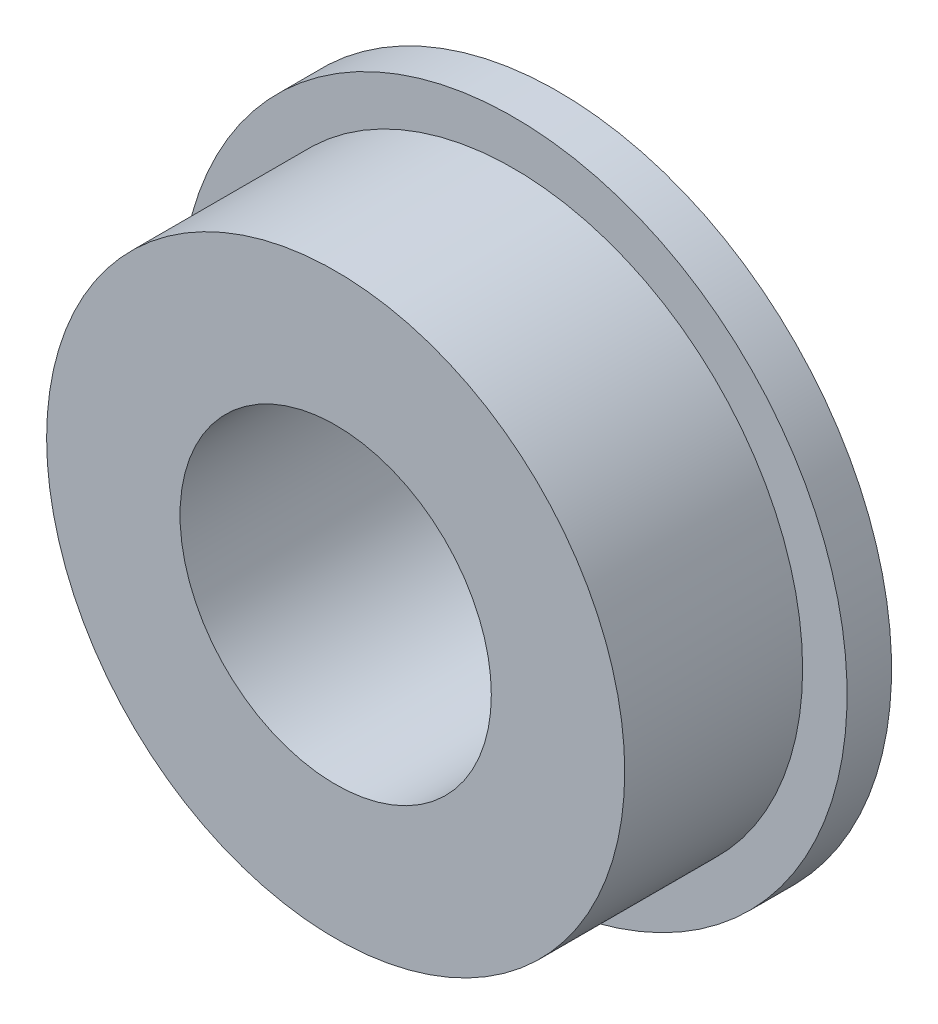
from build123d import *

# Parameters (mm, degrees)
SKETCH_1_R          = 6.5
EXTRUDE_1_DEPTH     = 5
SKETCH_2_R          = 7.5
EXTRUDE_2_DEPTH     = 1
SKETCH_3_R          = 3.5
CUT_EXTRUDE_1_DEPTH = 12.7260394


with BuildPart() as part:
    # ｽｹｯﾁ1 → ﾎﾞｽ - 押し出し1 (new body)
    with BuildSketch(Plane.XY):
        Circle(SKETCH_1_R)
    extrude(amount=EXTRUDE_1_DEPTH)

    # ｽｹｯﾁ2 → ﾎﾞｽ - 押し出し2 (add)
    with BuildSketch(Plane(origin=(0, 0, 0), x_dir=(-1, 0, 0), z_dir=(0, 0, -1))):
        Circle(SKETCH_2_R)
    extrude(amount=-EXTRUDE_2_DEPTH)

    # ｽｹｯﾁ3 → ｶｯﾄ - 押し出し1 (cut, through all)
    with BuildSketch(Plane.XY.offset(5)):
        Circle(SKETCH_3_R)
    extrude(amount=-CUT_EXTRUDE_1_DEPTH, mode=Mode.SUBTRACT)


solid = part.part
